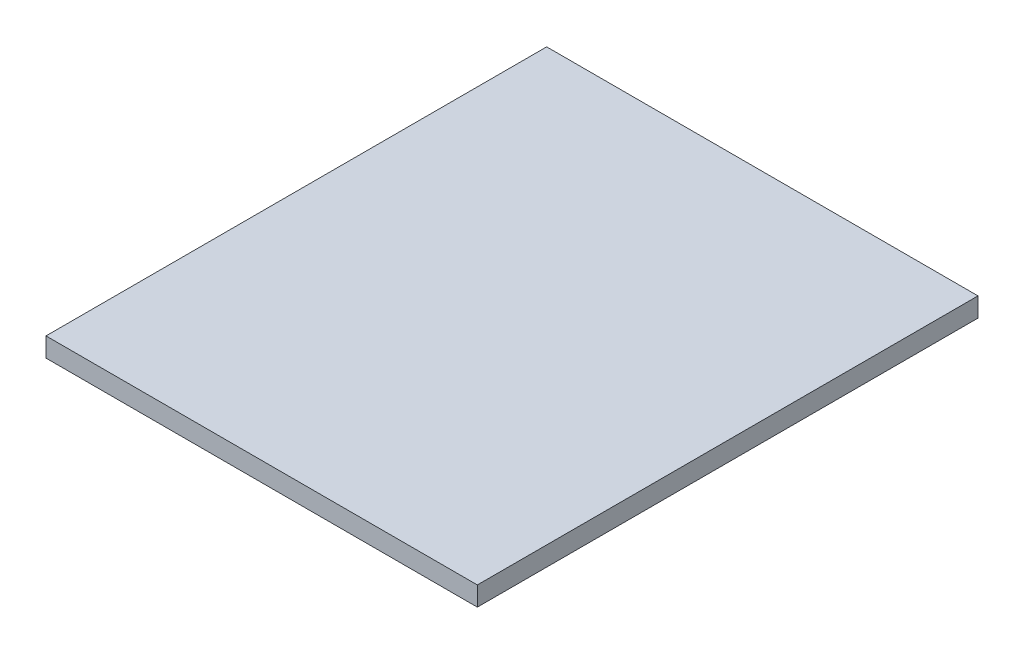
from build123d import *

# Parameters (mm, degrees)
SKETCH1_W           = 112
SKETCH1_H           = 130
BOSS_EXTRUDE1_DEPTH = 5


with BuildPart() as part:
    # Sketch1 → Boss-Extrude1 (new body)
    with BuildSketch(Plane(origin=(0, 0, 0), x_dir=(1, 0, 0), z_dir=(0, 1, 0))):
        with Locations((50, 65)):
            Rectangle(SKETCH1_W, SKETCH1_H)
    extrude(amount=BOSS_EXTRUDE1_DEPTH)


solid = part.part
